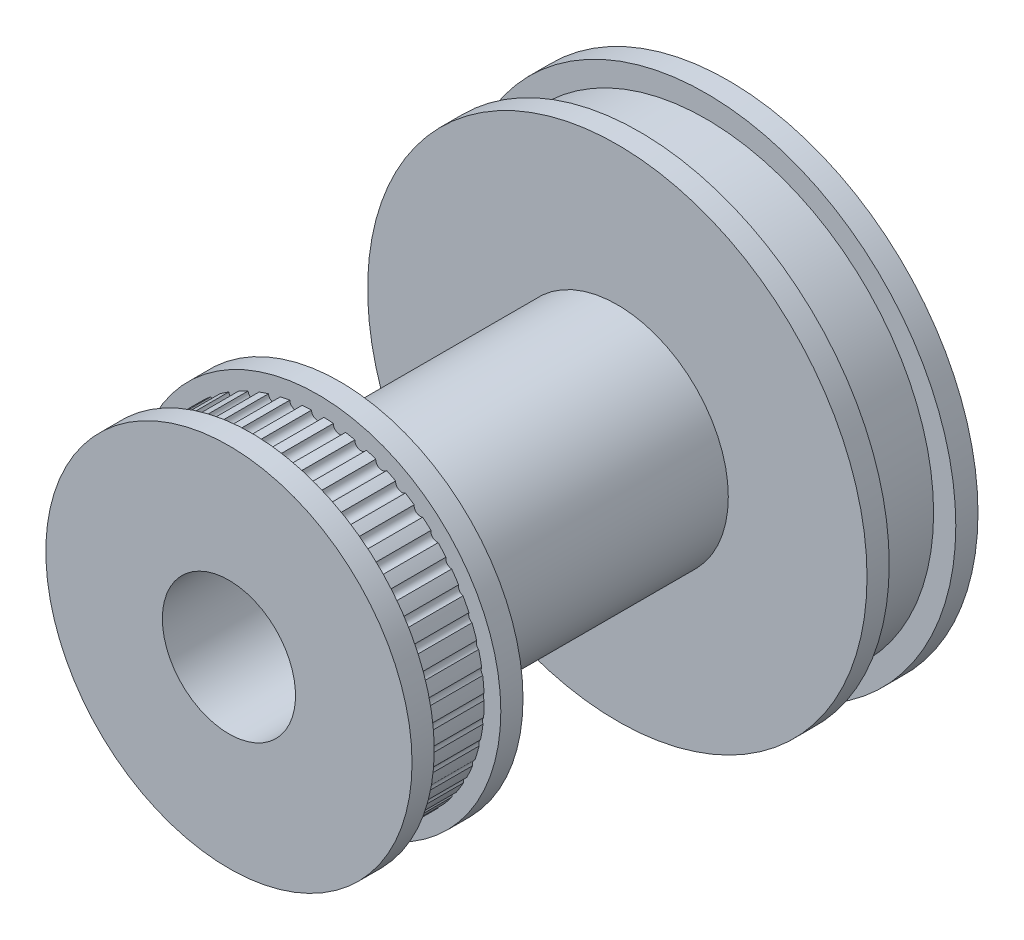
from build123d import *

# Parameters (mm, degrees)
SKIZZE1_R                        = 22.5
SEITE1_DEPTH                     = 2
SKIZZE2_R                        = 20.5
LAUFFL_CHE_DEPTH                 = 8
SKIZZE5_R                        = 22.5
SEITE_2_DEPTH                    = 2
BOHRUNG_DEPTH                    = 100
BOHRUNG_DEPTH_BACK               = 34.35416016
SKIZZE7_R                        = 2.5
SKIZZE9_R                        = 10
ZAPFEN_DEPTH                     = 25
SKIZZE10_R                       = 16.5
SEITENTEIL3_DEPTH                = 2
SKIZZE12_R                       = 15
ZAHNFL_CHE_DEPTH                 = 6
SKIZZE14_R                       = 0.56
RIEMENPROFIL_DEPTH               = 6
SKIZZE13_R                       = 16.5
SEITENTEIL4_DEPTH                = 2
F_12_0_12_DURCHMESSER_BOHRUNG1_D = 12


with BuildPart() as part:
    # Skizze1 → Seite1 (new body)
    with BuildSketch(Plane.XY):
        Circle(SKIZZE1_R)
    extrude(amount=SEITE1_DEPTH)

    # Skizze2 → Lauffläche (add)
    with BuildSketch(Plane.XY):
        Circle(SKIZZE2_R)
    extrude(amount=LAUFFL_CHE_DEPTH)

    # Skizze5 → Seite 2 (add)
    with BuildSketch(Plane.XY.offset(8)):
        Circle(SKIZZE5_R)
    extrude(amount=SEITE_2_DEPTH)

    # Skizze7 → Bohrung (cut, two sides: drawn at the far end of the back side and taken through both)
    with BuildSketch(Plane.XY.offset(-BOHRUNG_DEPTH_BACK)):
        Circle(SKIZZE7_R)
    extrude(amount=BOHRUNG_DEPTH + BOHRUNG_DEPTH_BACK, mode=Mode.SUBTRACT)

    # Skizze9 → Zapfen (add)
    with BuildSketch(Plane.XY.offset(10)):
        Circle(SKIZZE9_R)
    extrude(amount=ZAPFEN_DEPTH)

    # Skizze10 → Seitenteil3 (add)
    with BuildSketch(Plane.XY.offset(35)):
        Circle(SKIZZE10_R)
    extrude(amount=SEITENTEIL3_DEPTH)

    # Skizze12 → Zahnfläche (add)
    with BuildSketch(Plane.XY.offset(37)):
        Circle(SKIZZE12_R)
    extrude(amount=ZAHNFL_CHE_DEPTH)

    # Skizze14 → Riemenprofil (cut)
    with BuildSketch(Plane.XY.offset(43)):
        with Locations((0, 15)):
            Circle(SKIZZE14_R)
        with Locations((1.966556951, 14.928861044)):
            Circle(SKIZZE14_R)
        with Locations((3.907004237, 14.6016435)):
            Circle(SKIZZE14_R)
        with Locations((5.788140268, 14.023946153)):
            Circle(SKIZZE14_R)
        with Locations((7.577778284, 13.205653563)):
            Circle(SKIZZE14_R)
        with Locations((9.245297083, 12.160766945)):
            Circle(SKIZZE14_R)
        with Locations((10.762164956, 10.907164596)):
            Circle(SKIZZE14_R)
        with Locations((12.102427872, 9.466296002)):
            Circle(SKIZZE14_R)
        with Locations((13.243153563, 7.862814824)):
            Circle(SKIZZE14_R)
        with Locations((14.164823895, 6.124157069)):
            Circle(SKIZZE14_R)
        with Locations((14.851668833, 4.280071652)):
            Circle(SKIZZE14_R)
        with Locations((15.29193627, 2.362111388)):
            Circle(SKIZZE14_R)
        with Locations((15.478093108, 0.403093108)):
            Circle(SKIZZE14_R)
        with Locations((15.406954151, -1.563463843)):
            Circle(SKIZZE14_R)
        with Locations((15.079736608, -3.503911129)):
            Circle(SKIZZE14_R)
        with Locations((14.502039261, -5.38504716)):
            Circle(SKIZZE14_R)
        with Locations((13.683746671, -7.174685176)):
            Circle(SKIZZE14_R)
        with Locations((12.638860052, -8.842203975)):
            Circle(SKIZZE14_R)
        with Locations((11.385257704, -10.359071848)):
            Circle(SKIZZE14_R)
        with Locations((9.94438911, -11.699334765)):
            Circle(SKIZZE14_R)
        with Locations((8.340907932, -12.840060456)):
            Circle(SKIZZE14_R)
        with Locations((6.602250176, -13.761730787)):
            Circle(SKIZZE14_R)
        with Locations((4.75816476, -14.448575725)):
            Circle(SKIZZE14_R)
        with Locations((2.840204496, -14.888843162)):
            Circle(SKIZZE14_R)
        with Locations((0.881186216, -15.075)):
            Circle(SKIZZE14_R)
        with Locations((-1.085370735, -15.003861044)):
            Circle(SKIZZE14_R)
        with Locations((-3.025818021, -14.6766435)):
            Circle(SKIZZE14_R)
        with Locations((-4.906954052, -14.098946153)):
            Circle(SKIZZE14_R)
        with Locations((-6.696592068, -13.280653563)):
            Circle(SKIZZE14_R)
        with Locations((-8.364110867, -12.235766945)):
            Circle(SKIZZE14_R)
        with Locations((-9.88097874, -10.982164596)):
            Circle(SKIZZE14_R)
        with Locations((-11.221241657, -9.541296002)):
            Circle(SKIZZE14_R)
        with Locations((-12.361967348, -7.937814824)):
            Circle(SKIZZE14_R)
        with Locations((-13.28363768, -6.199157069)):
            Circle(SKIZZE14_R)
        with Locations((-13.970482618, -4.355071652)):
            Circle(SKIZZE14_R)
        with Locations((-14.410750054, -2.437111388)):
            Circle(SKIZZE14_R)
        with Locations((-14.596906892, -0.478093108)):
            Circle(SKIZZE14_R)
        with Locations((-14.525767936, 1.488463843)):
            Circle(SKIZZE14_R)
        with Locations((-14.198550392, 3.428911129)):
            Circle(SKIZZE14_R)
        with Locations((-13.620853045, 5.31004716)):
            Circle(SKIZZE14_R)
        with Locations((-12.802560456, 7.099685176)):
            Circle(SKIZZE14_R)
        with Locations((-11.757673837, 8.767203975)):
            Circle(SKIZZE14_R)
        with Locations((-10.504071489, 10.284071848)):
            Circle(SKIZZE14_R)
        with Locations((-9.063202895, 11.624334765)):
            Circle(SKIZZE14_R)
        with Locations((-7.459721716, 12.765060456)):
            Circle(SKIZZE14_R)
        with Locations((-5.721063961, 13.686730787)):
            Circle(SKIZZE14_R)
        with Locations((-3.876978545, 14.373575725)):
            Circle(SKIZZE14_R)
        with Locations((-1.95901828, 14.813843162)):
            Circle(SKIZZE14_R)
    extrude(amount=-RIEMENPROFIL_DEPTH, mode=Mode.SUBTRACT)

    # Skizze13 → Seitenteil4 (add)
    with BuildSketch(Plane.XY.offset(43)):
        Circle(SKIZZE13_R)
    extrude(amount=SEITENTEIL4_DEPTH)

    # Ø12.0 (12) Durchmesser Bohrung1 (through all)
    with Locations(Plane(origin=(0, 0, 0), x_dir=(-1, 0, 0), z_dir=(0, 0, -1))):
        with Locations((0, 0)):
            Hole(F_12_0_12_DURCHMESSER_BOHRUNG1_D / 2)


solid = part.part
